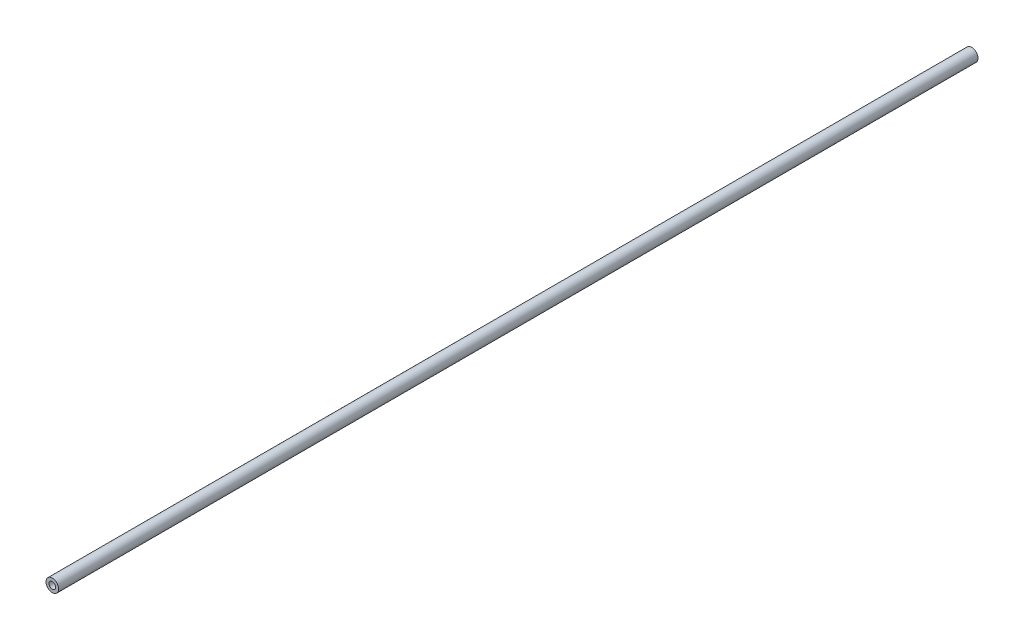
from build123d import *

# Parameters (mm, degrees)
SKETCH1_R           = 4.7625
SKETCH1_R_2         = 2.4892
BOSS_EXTRUDE1_DEPTH = 692.15


with BuildPart() as part:
    # Sketch1 → Boss-Extrude1 (new body)
    with BuildSketch(Plane.XY):
        Circle(SKETCH1_R)
        Circle(SKETCH1_R_2, mode=Mode.SUBTRACT)
    extrude(amount=BOSS_EXTRUDE1_DEPTH)


solid = part.part
